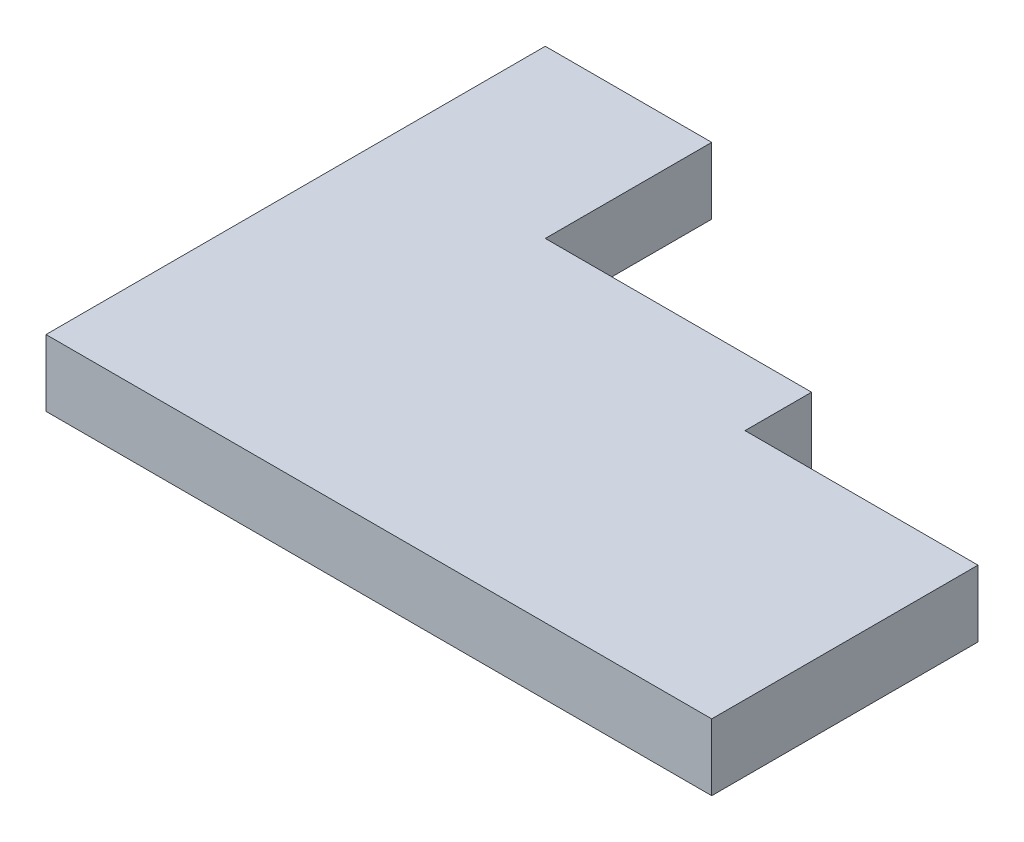
from build123d import *

# Parameters (mm, degrees)
BOSS_EXTRUDE1_DEPTH = 2


with BuildPart() as part:
    # Sketch1 → Boss-Extrude1 (new body)
    with BuildSketch(Plane(origin=(0, 0, 0), x_dir=(1, 0, 0), z_dir=(0, 1, 0))):
        Polygon((0, 0), (20, 0), (20, 8), (13, 8), (13, 10), (5, 10), (5, 15), (0, 15), align=None)
    extrude(amount=BOSS_EXTRUDE1_DEPTH)


solid = part.part
